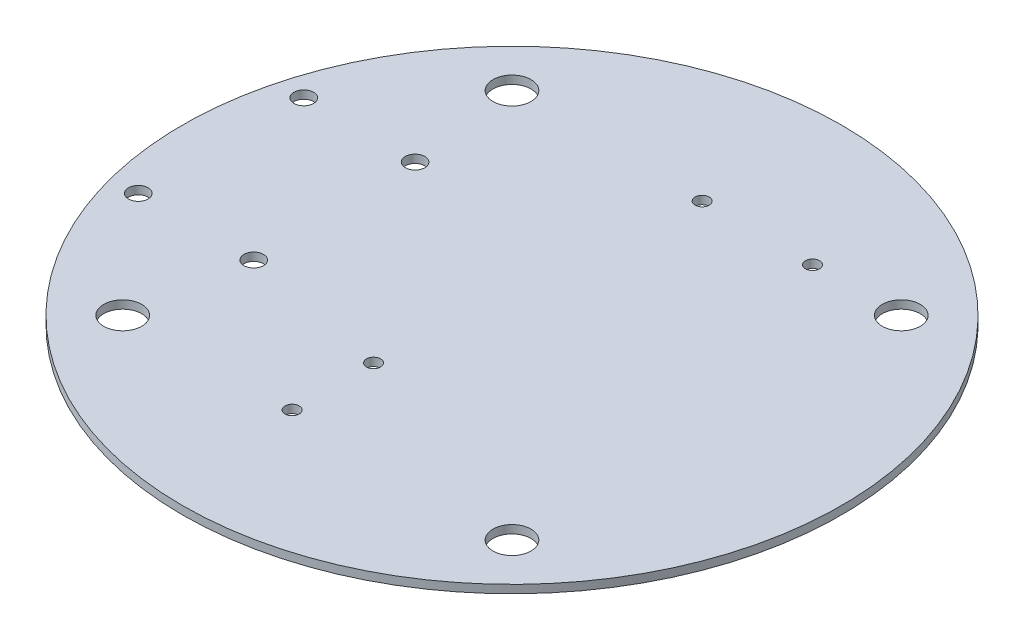
from build123d import *

# Parameters (mm, degrees)
SKETCH1_R            = 60.7
BOSS_EXTRUDE1_DEPTH  = 1.5
M6_CLEARANCE_HOLE1_D = 7
CIRPATTERN1_COUNT    = 4
M2_CLEARANCE_HOLE1_D = 2.6
M3_CLEARANCE_HOLE2_D = 3.6


with BuildPart() as part:
    # Sketch1 → Boss-Extrude1 (new body)
    with BuildSketch(Plane(origin=(0, 0, 0), x_dir=(1, 0, 0), z_dir=(0, 1, 0))):
        with Locations(Location((0, 0, 0), (0, 0, 270))):
            Circle(SKETCH1_R)
    extrude(amount=BOSS_EXTRUDE1_DEPTH)

    # M6 Clearance Hole1 (through all)
    with Locations(Plane(origin=(0, 1.5, 0), x_dir=(1, 0, 0), z_dir=(0, 1, 0))):
        with Locations((-35.850313806, -35.850313806)):
            m6_clearance_hole1 = Hole(M6_CLEARANCE_HOLE1_D / 2)

    # CirPattern1: M6 Clearance Hole1 ×4 about axis
    cirpattern1_axis = Axis((0, 0, 0), (0, 1, 0))
    for i in range(1, CIRPATTERN1_COUNT):
        add(m6_clearance_hole1.rotate(cirpattern1_axis, i * 360 / CIRPATTERN1_COUNT), mode=Mode.SUBTRACT)

    # M2 Clearance Hole1 (through all)
    with Locations(Plane(origin=(0, 1.5, 0), x_dir=(1, 0, 0), z_dir=(0, 1, 0))):
        with Locations((-0.709999951, 35.730000111), (19.610000128, 35.730000136), (-5.154, -20.350313806), (-5.154, -35.350313806)):
            Hole(M2_CLEARANCE_HOLE1_D / 2)

    # M3 Clearance Hole2 (through all)
    with Locations(Plane(origin=(0, 1.5, 0), x_dir=(1, 0, 0), z_dir=(0, 1, 0))):
        with Locations((-53.86454119, 15.511690642), (-53.864546519, -14.968309358), (-32.604546519, -14.968313075), (-33.36654119, 15.511687058)):
            Hole(M3_CLEARANCE_HOLE2_D / 2)


solid = part.part
